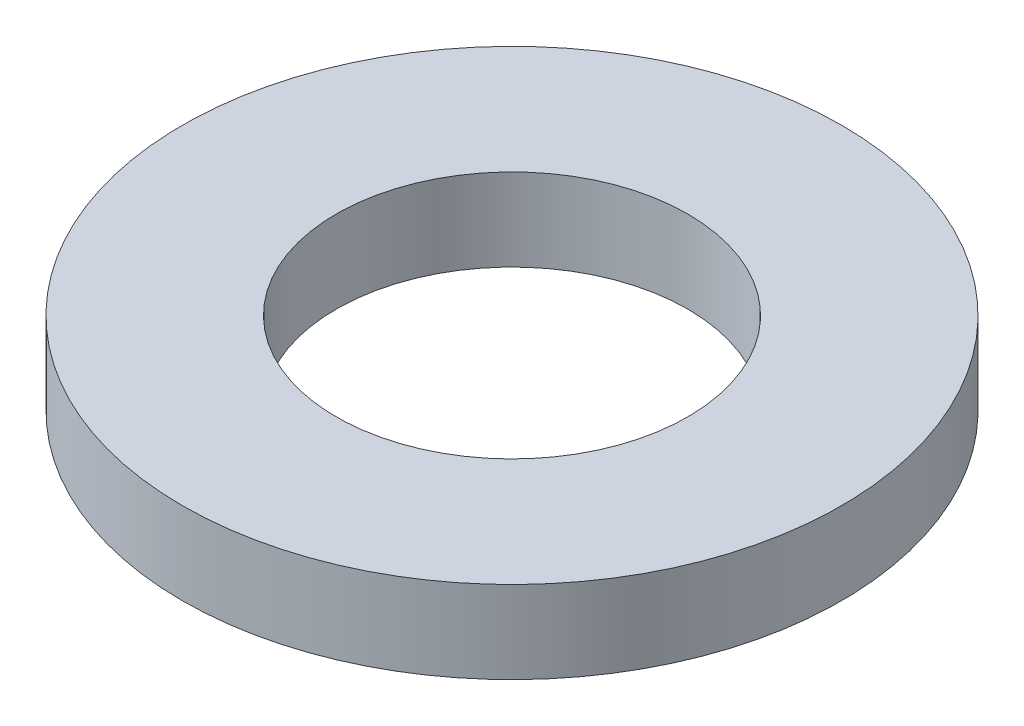
from build123d import *

# Parameters (mm, degrees)
SKETCH1_R           = 6
SKETCH1_R_2         = 3.2
BOSS_EXTRUDE1_DEPTH = 1.5


with BuildPart() as part:
    # Sketch1 → Boss-Extrude1 (new body)
    with BuildSketch(Plane(origin=(0, 0, 0), x_dir=(1, 0, 0), z_dir=(0, 1, 0))):
        with Locations(Location((0, 0, 0), (0, 0, 270))):
            Circle(SKETCH1_R)
        with Locations(Location((0, 0, 0), (0, 0, 270))):
            Circle(SKETCH1_R_2, mode=Mode.SUBTRACT)
    extrude(amount=BOSS_EXTRUDE1_DEPTH)


solid = part.part
